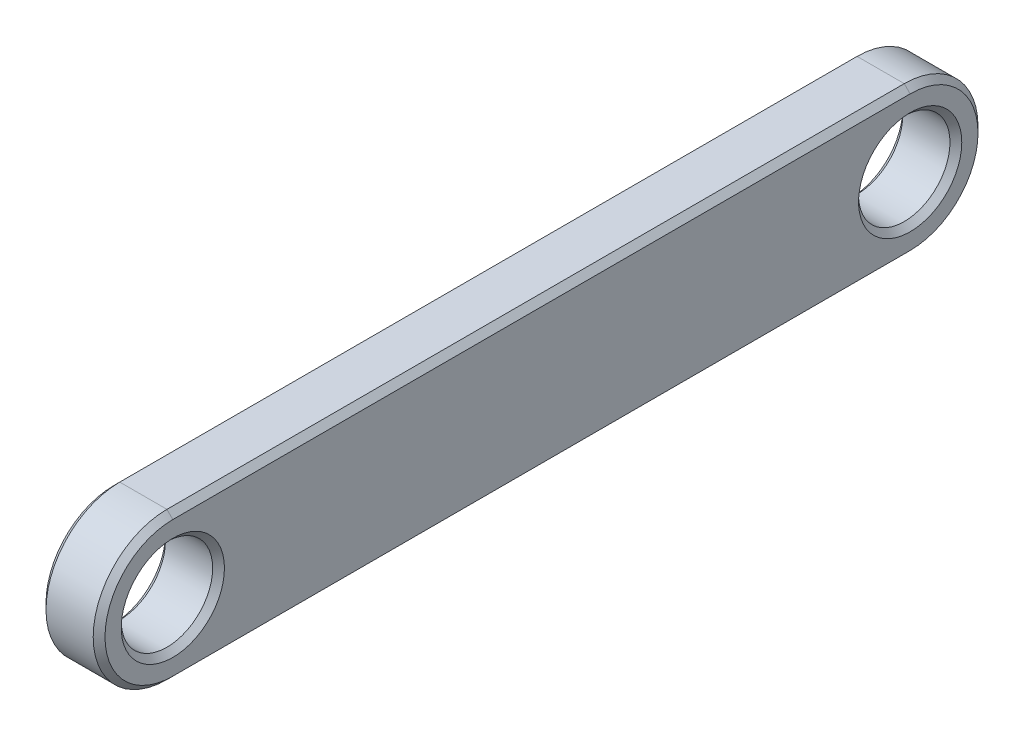
from build123d import *

# Parameters (mm, degrees)
SKETCH1_R           = 1.55
BOSS_EXTRUDE1_DEPTH = 2
CHAMFER1_SIZE       = 0.2


with BuildPart() as part:
    # Sketch1 → Boss-Extrude1 (new body)
    with BuildSketch(Plane(origin=(0, 0, 0), x_dir=(0, 0, -1), z_dir=(1, 0, 0))):
        with BuildLine():
            Line((-12.5, 2.5), (12.5, 2.5))
            ThreePointArc((12.5, 2.5), (15, 0), (12.5, -2.5))
            Line((12.5, -2.5), (-12.5, -2.5))
            ThreePointArc((-12.5, -2.5), (-15, 0), (-12.5, 2.5))
        make_face()
        with Locations((-12.5, 0)):
            Circle(SKETCH1_R, mode=Mode.SUBTRACT)
        with Locations((12.5, 0)):
            Circle(SKETCH1_R, mode=Mode.SUBTRACT)
    extrude(amount=BOSS_EXTRUDE1_DEPTH)

    # Chamfer1
    chamfer1_edges = [part.edges().sort_by_distance(p)[0] for p in [
        (0, 0, 14.05),
        (2, 0, 14.05),
        (2, 0, -15),
        (0, 0, -10.95),
        (2, 0, -10.95),
        (2, 2.5, 0),
        (2, 0, 15),
        (0, 2.5, 0),
        (0, 0, -15),
        (0, -2.5, 0),
        (0, 0, 15),
        (2, -2.5, 0),
    ]]
    chamfer(chamfer1_edges, length=CHAMFER1_SIZE)


solid = part.part
